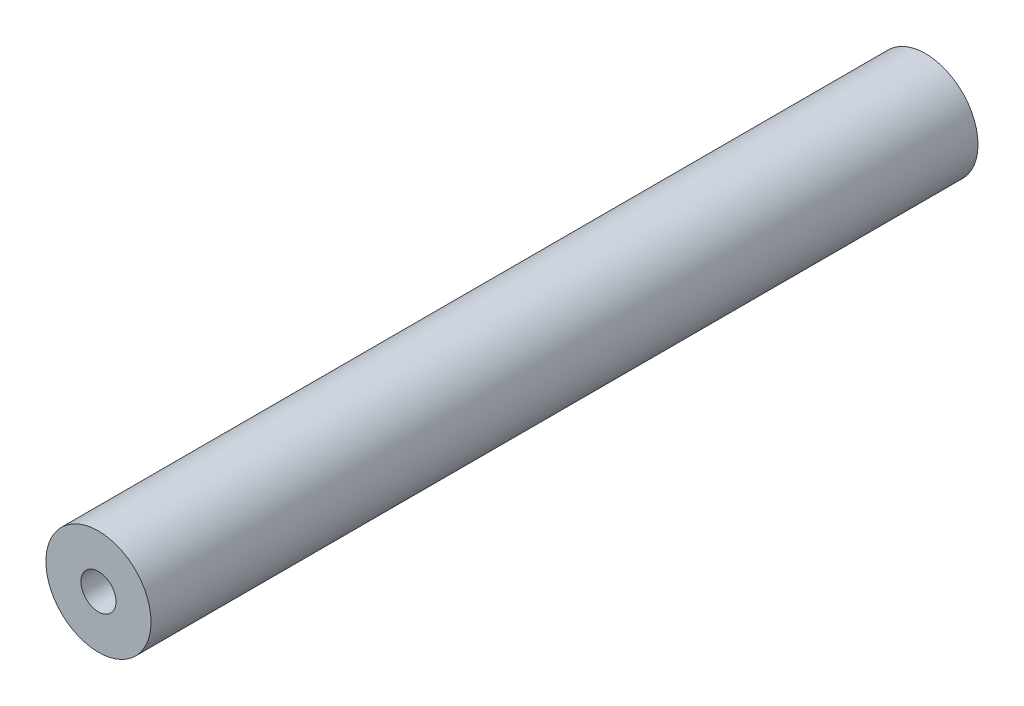
from build123d import *

# Parameters (mm, degrees)
SKETCH1_R           = 15
SKETCH1_R_2         = 5
BOSS_EXTRUDE1_DEPTH = 118


with BuildPart() as part:
    # Sketch1 → Boss-Extrude1 (new, symmetric)
    with BuildSketch(Plane(origin=(0, 0, 0), x_dir=(0, 1, 0), z_dir=(0, 0, 1))):
        with Locations(Location((0, 0, 0), (0, 0, 270))):
            Circle(SKETCH1_R)
        with Locations(Location((0, 0, 0), (0, 0, 270))):
            Circle(SKETCH1_R_2, mode=Mode.SUBTRACT)
    extrude(amount=BOSS_EXTRUDE1_DEPTH, both=True)


solid = part.part
